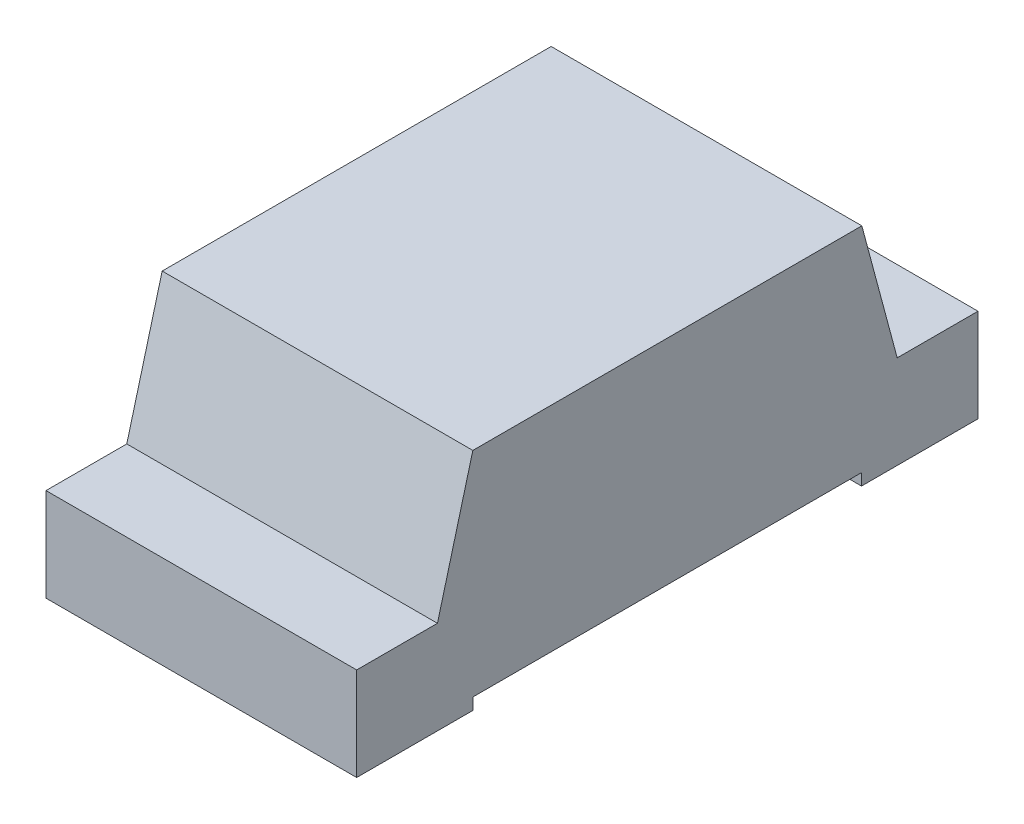
from build123d import *

# Parameters (mm, degrees)
BOSS_EXTRUDE1_DEPTH = 0.4


with BuildPart() as part:
    # Sketch2 → Boss-Extrude1 (new, symmetric)
    with BuildSketch(Plane(origin=(0, 0, 0), x_dir=(0, 0, -1), z_dir=(1, 0, 0))):
        Polygon((0.5, 0.03), (-0.5, 0.03), (-0.5, 0), (-0.8, 0), (-0.8, 0.24), (-0.591961524, 0.24), (-0.500858799, 0.58), (0.500858799, 0.58), (0.591961524, 0.24), (0.8, 0.24), (0.8, 0), (0.5, 0), align=None)
    extrude(amount=BOSS_EXTRUDE1_DEPTH, both=True)


solid = part.part
